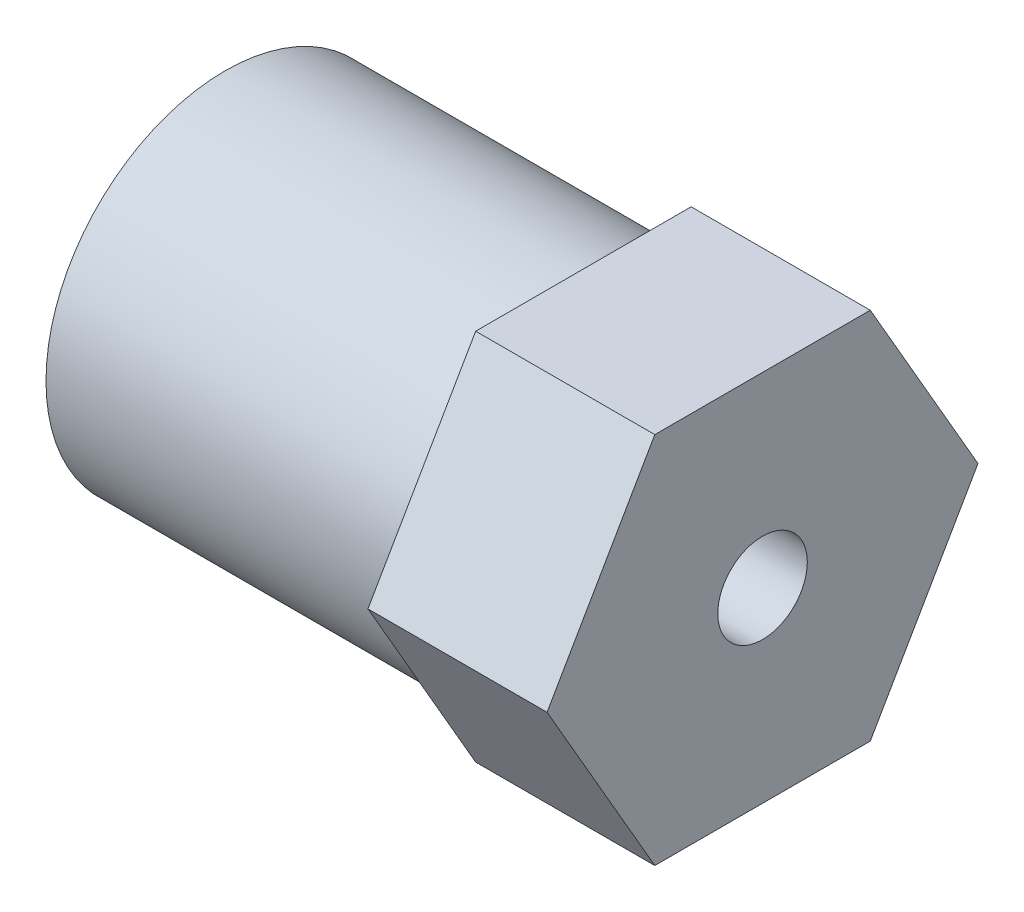
from build123d import *

# Parameters (mm, degrees)
BOSS_EXTRUDE1_DEPTH = 6
SKETCH2_R           = 6
BOSS_EXTRUDE2_DEPTH = 12
SKETCH3_R           = 3
CUT_EXTRUDE1_DEPTH  = 12
SKETCH4_R           = 1.5
CUT_EXTRUDE2_DEPTH  = 21.375127811


with BuildPart() as part:
    # Sketch1 → Boss-Extrude1 (new body)
    with BuildSketch(Plane(origin=(0, 0, 0), x_dir=(0, 0, -1), z_dir=(1, 0, 0))):
        Polygon((7.216878365, 0), (3.608439182, 6.25), (-3.608439182, 6.25), (-7.216878365, 0), (-3.608439182, -6.25), (3.608439182, -6.25), align=None)
    extrude(amount=BOSS_EXTRUDE1_DEPTH)

    # Sketch2 → Boss-Extrude2 (add)
    with BuildSketch(Plane.ZY):
        with Locations(Location((0, 0, 0), (0, 0, 180))):
            Circle(SKETCH2_R)
    extrude(amount=BOSS_EXTRUDE2_DEPTH)

    # Sketch3 → Cut-Extrude1 (cut)
    with BuildSketch(Plane.ZY.offset(12)):
        Circle(SKETCH3_R)
    extrude(amount=-CUT_EXTRUDE1_DEPTH, mode=Mode.SUBTRACT)

    # Sketch4 → Cut-Extrude2 (cut, through all)
    with BuildSketch(Plane(origin=(6, 0, 0), x_dir=(0, 0, -1), z_dir=(1, 0, 0))):
        Circle(SKETCH4_R)
    extrude(amount=-CUT_EXTRUDE2_DEPTH, mode=Mode.SUBTRACT)


solid = part.part
